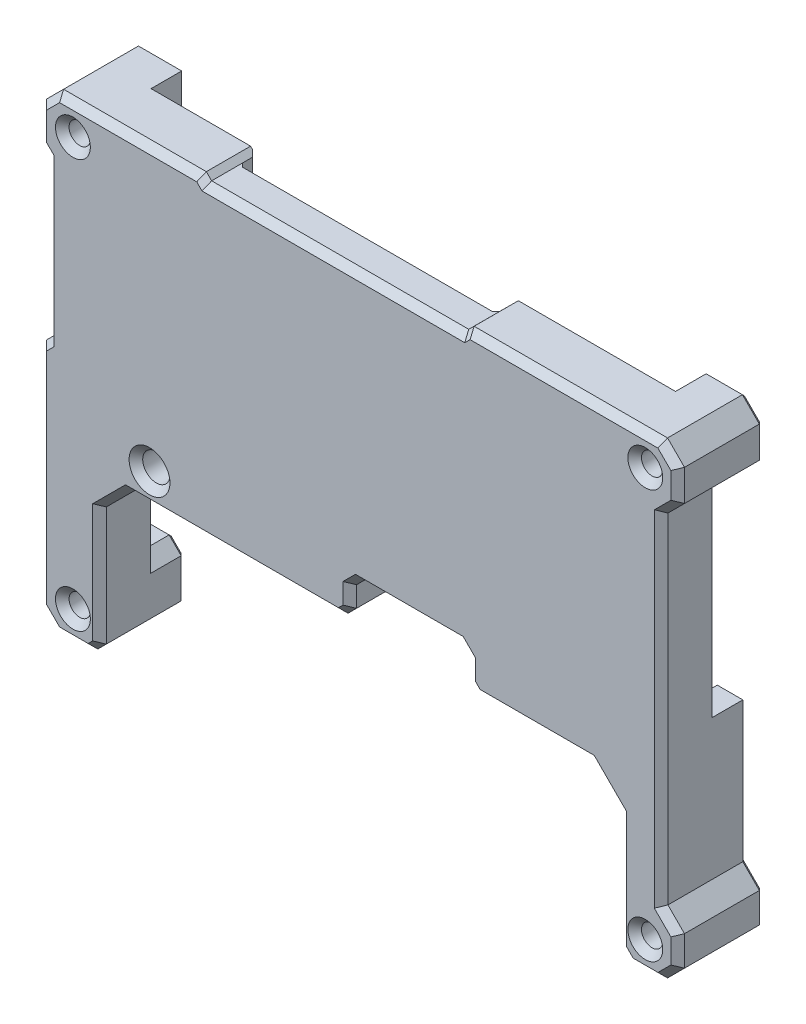
from build123d import *

# Parameters (mm, degrees)
SKETCH_1_W                = 85
SKETCH_1_H                = 65
EXTRUDE_1_DEPTH           = 10
CUT_EXTRUDE_1_REACH       = 109.471
SKETCH_2_R                = 1.25
CUT_EXTRUDE_2_REACH       = 109.471
SKETCH_3_W                = 85
SKETCH_3_H                = 65
CUT_EXTRUDE_4_REACH       = 102.464
CUT_EXTRUDE_7_DEPTH       = 6
CUT_EXTRUDE_8_DEPTH       = 6
CUT_EXTRUDE_11_DEPTH      = 4
SKETCH_8_W                = 8
SKETCH_8_H                = 5
CUT_EXTRUDE_12_DEPTH      = 1
SKETCH_10_W               = 5.4
SKETCH_10_H               = 6
SKETCH_10_W_2             = 4
EXTRUDE_2_DEPTH           = 2.040000001
SKETCH_11_W               = 4.2
SKETCH_11_H               = 5
EXTRUDE_3_DEPTH           = 1.300114616
SKETCH_12_W               = 12
SKETCH_12_H               = 6
EXTRUDE_4_DEPTH           = 1.89
SKETCH_13_W               = 3.114456334
SKETCH_13_H               = 4.982674998
EXTRUDE_5_DEPTH           = 4
SKETCH_15_W               = 14
SKETCH_15_H               = 4.4
CUT_EXTRUDE_13_DEPTH      = 6
CHAMFER_1_SIZE            = 1
CHAMFER_2_SIZE            = 0.6
CHAMFER_5_SIZE            = 0.6
CUT_EXTRUDE_14_DEPTH      = 101.144527295
CUT_EXTRUDE_14_DEPTH_BACK = 101.144527295
SKETCH_16_R               = 1.6
CUT_EXTRUDE_15_DEPTH      = 4
CUT_EXTRUDE_16_DEPTH      = 4
CHAMFER_6_SIZE            = 0.8
CHAMFER_7_SIZE            = 0.4
CHAMFER_8_SIZE            = 0.4
CHAMFER_9_SIZE            = 0.4
CHAMFER_11_SIZE           = 0.4


with BuildPart() as part:
    # 草图1 → 凸台-拉伸1 (new body)
    with BuildSketch(Plane.XY):
        with Locations((42.5, 32.5)):
            Rectangle(SKETCH_1_W, SKETCH_1_H)
    extrude(amount=EXTRUDE_1_DEPTH)

    # 草图2 → 切除-拉伸1 (cut, up to next)
    with BuildSketch(Plane(origin=(0, 0, 0), x_dir=(-1, 0, 0), z_dir=(0, 0, -1)), mode=Mode.PRIVATE) as cut_extrude_1_sk1:
        with Locations((-76.166921514, 56.442524765)):
            Circle(SKETCH_2_R)
    cut_extrude_1_tool1 = extrude(cut_extrude_1_sk1.sketch, amount=-CUT_EXTRUDE_1_REACH, mode=Mode.PRIVATE) & part.part
    # 草图2 → 切除-拉伸1 (cut, up to next)
    with BuildSketch(Plane(origin=(0, 0, 0), x_dir=(-1, 0, 0), z_dir=(0, 0, -1)), mode=Mode.PRIVATE) as cut_extrude_1_sk2:
        with Locations((-8.888803658, 56.442524765)):
            Circle(SKETCH_2_R)
    cut_extrude_1_tool2 = extrude(cut_extrude_1_sk2.sketch, amount=-CUT_EXTRUDE_1_REACH, mode=Mode.PRIVATE) & part.part
    # 草图2 → 切除-拉伸1 (cut, up to next)
    with BuildSketch(Plane(origin=(0, 0, 0), x_dir=(-1, 0, 0), z_dir=(0, 0, -1)), mode=Mode.PRIVATE) as cut_extrude_1_sk3:
        with Locations((-76.166921514, 8.41508509)):
            Circle(SKETCH_2_R)
    cut_extrude_1_tool3 = extrude(cut_extrude_1_sk3.sketch, amount=-CUT_EXTRUDE_1_REACH, mode=Mode.PRIVATE) & part.part
    # 草图2 → 切除-拉伸1 (cut, up to next)
    with BuildSketch(Plane(origin=(0, 0, 0), x_dir=(-1, 0, 0), z_dir=(0, 0, -1)), mode=Mode.PRIVATE) as cut_extrude_1_sk4:
        with Locations((-8.888803658, 8.41508509)):
            Circle(SKETCH_2_R)
    cut_extrude_1_tool4 = extrude(cut_extrude_1_sk4.sketch, amount=-CUT_EXTRUDE_1_REACH, mode=Mode.PRIVATE) & part.part
    add(cut_extrude_1_tool1.solids().sort_by_distance((76.166922, 56.442525, 0))[0], mode=Mode.SUBTRACT)
    add(cut_extrude_1_tool2.solids().sort_by_distance((8.888804, 56.442525, 0))[0], mode=Mode.SUBTRACT)
    add(cut_extrude_1_tool3.solids().sort_by_distance((76.166922, 8.415085, 0))[0], mode=Mode.SUBTRACT)
    add(cut_extrude_1_tool4.solids().sort_by_distance((8.888804, 8.415085, 0))[0], mode=Mode.SUBTRACT)

    # 草图3 → 切除-拉伸2 (cut, up to next)
    with BuildSketch(Plane(origin=(0, 0, 0), x_dir=(-1, 0, 0), z_dir=(0, 0, -1)), mode=Mode.PRIVATE) as cut_extrude_2_sk1:
        with Locations((-42.5, 32.5)):
            Rectangle(SKETCH_3_W, SKETCH_3_H)
        Polygon((-5, 33.462892894), (-5.871324699, 34.334217592), (-5.87504445, 53.137061214), (-5, 54.017366187), (-5, 57.982143592), (-6.992565577, 59.974709169), (-23.773560915, 59.974709169), (-24.394872914, 59.353397171), (-54.61482093, 59.349677419), (-55.245113202, 59.974709169), (-77.982184232, 59.974709169), (-79.974749809, 57.982143592), (-79.97474981, 54.295829484), (-78.032030648, 52.353110322), (-78.028310897, 12.45999492), (-79.97474981, 10.508295484), (-79.97474981, 6.992565577), (-77.982184232, 5), (-74.414239441, 5), (-73.152434681, 6.26180476), (-60.043505207, 6.265524511), (-58.772720173, 5), (-32.926479725, 5), (-31.743585303, 6.182894422), (-17.461559563, 6.186614173), (-16.269684867, 5), (-6.992565577, 5), (-5, 6.992565577), align=None, mode=Mode.SUBTRACT)
    cut_extrude_2_tool1 = extrude(cut_extrude_2_sk1.sketch, amount=-CUT_EXTRUDE_2_REACH, mode=Mode.PRIVATE) & part.part
    add(cut_extrude_2_tool1.solids().sort_by_distance((42.5, 63.929953, 0))[0], mode=Mode.SUBTRACT)

    # 草图4 → 切除-拉伸4 (cut, up to next)
    with BuildSketch(Plane(origin=(0, 0, 0), x_dir=(-1, 0, 0), z_dir=(0, 0, -1)), mode=Mode.PRIVATE) as cut_extrude_4_sk1:
        Polygon((-73.152434681, 6.26180476), (-73.152434681, 20.032317315), (-69.831576581, 23.353175415), (-46.787984184, 23.353175415), (-15.403761553, 23.353175415), (-12.014024846, 19.963438707), (-12.014024846, 6.188032983), (-12.014024846, 0.193960815), (-73.152434681, 0.193960815), align=None)
    cut_extrude_4_tool1 = extrude(cut_extrude_4_sk1.sketch, amount=-CUT_EXTRUDE_4_REACH, mode=Mode.PRIVATE) & part.part
    add(cut_extrude_4_tool1.solids().sort_by_distance((42.587983, 11.689717, 0))[0], mode=Mode.SUBTRACT)

    # 草图5 → 切除-拉伸7 (cut)
    with BuildSketch(Plane(origin=(0, 0, 0), x_dir=(-1, 0, 0), z_dir=(0, 0, -1))):
        Polygon((-24.394872914, 59.353397171), (-24.394872914, 53.906418167), (-25.526104495, 52.774908066), (-53.482640788, 52.774908066), (-54.614150889, 53.906139647), (-54.61482093, 59.349677419), align=None)
    extrude(amount=-CUT_EXTRUDE_7_DEPTH, mode=Mode.SUBTRACT)

    # 草图6 → 切除-拉伸8 (cut)
    with BuildSketch(Plane(origin=(0, 0, 0), x_dir=(-1, 0, 0), z_dir=(0, 0, -1))):
        Polygon((-5.871324699, 34.334217592), (-11.671324699, 34.334217592), (-11.671324699, 50.334217592), (-5.874489966, 50.334217592), (-5.873484235, 45.250384759), align=None)
    extrude(amount=-CUT_EXTRUDE_8_DEPTH, mode=Mode.SUBTRACT)

    # 草图7 → 切除-拉伸11 (cut)
    with BuildSketch(Plane(origin=(0, 0, 0), x_dir=(-1, 0, 0), z_dir=(0, 0, -1))):
        Polygon((-74.432117646, 51.26230094), (-76.432117646, 51.26230094), (-78.031928938, 51.26230094), (-78.029847328, 28.93771831), (-75.029847328, 28.93771831), (-75.029847328, 13.93771831), (-73.152434681, 12.060305663), (-73.152434681, 20.032317315), (-69.831576581, 23.353175415), (-15.403761553, 23.353175415), (-12.014024846, 19.963438707), (-12.014024846, 10.599811284), (-10.599811284, 12.014024847), (-6.599811284, 12.014024847), (-5, 12.014024847), (-5, 33.462892894), (-5.871324699, 34.334217592), (-11.671324699, 34.334217592), (-11.671324699, 50.334217592), (-5.874489966, 50.334217592), (-5.87504445, 53.137061214), (-9.87504445, 53.137061214), (-12.071959353, 55.333976117), (-12.071959353, 58.333976117), (-23.061659554, 58.333976117), (-23.732127818, 57.663342778), (-24.394872914, 57.663261201), (-24.394872914, 53.906418167), (-25.526104495, 52.774908066), (-53.482640788, 52.774908066), (-54.614150889, 53.906139647), (-54.61482093, 59.349677419), (-55.245113202, 59.974709169), (-71.319520701, 59.974709169), (-71.319520701, 58.374897885), (-71.319520701, 54.374897885), align=None)
    extrude(amount=-CUT_EXTRUDE_11_DEPTH, mode=Mode.SUBTRACT)

    # 草图8 → 切除-拉伸12 (cut)
    with BuildSketch(Plane(origin=(0, 0, 4), x_dir=(-1, 0, 0), z_dir=(0, 0, -1))):
        with Locations((-69.348077333, 43.45871309)):
            Rectangle(SKETCH_8_W, SKETCH_8_H)
    extrude(amount=-CUT_EXTRUDE_12_DEPTH, mode=Mode.SUBTRACT)

    # 草图10 → 凸台-拉伸2 (add)
    with BuildSketch(Plane(origin=(0, 0, 4), x_dir=(-1, 0, 0), z_dir=(0, 0, -1))):
        with Locations((-44.246532103, 31.889800214)):
            Rectangle(SKETCH_10_W, SKETCH_10_H)
        with Locations((-39.546532103, 31.889800214)):
            Rectangle(SKETCH_10_W_2, SKETCH_10_H)
        with Locations((-34.846532103, 31.889800214)):
            Rectangle(SKETCH_10_W, SKETCH_10_H)
    extrude(amount=EXTRUDE_2_DEPTH)

    # 草图11 → 凸台-拉伸3 (add)
    with BuildSketch(Plane(origin=(0, 0, 4), x_dir=(-1, 0, 0), z_dir=(0, 0, -1))):
        with Locations((-38.731800654, 41.192864876)):
            Rectangle(SKETCH_11_W, SKETCH_11_H)
    extrude(amount=EXTRUDE_3_DEPTH)

    # 草图12 → 凸台-拉伸4 (add)
    with BuildSketch(Plane(origin=(0, 0, 4), x_dir=(-1, 0, 0), z_dir=(0, 0, -1))):
        with Locations((-24.610605003, 27.685920752)):
            Rectangle(SKETCH_12_W, SKETCH_12_H)
        Polygon((-30.610605003, 30.685920752), (-24.610605003, 30.685920752), (-32.146532103, 34.889800214), (-32.146532103, 28.889800214), (-30.610605003, 27.685920752), align=None)
    extrude(amount=EXTRUDE_4_DEPTH)

    # 草图13 → 凸台-拉伸5 (add)
    with BuildSketch(Plane(origin=(0, 0, 4), x_dir=(-1, 0, 0), z_dir=(0, 0, -1))):
        with Locations((-61.333013133, 38.127509711)):
            Rectangle(SKETCH_13_W, SKETCH_13_H)
    extrude(amount=EXTRUDE_5_DEPTH)

    # 草图15 → 切除-拉伸13 (cut)
    with BuildSketch(Plane.XY.offset(10)):
        with Locations((48.428848604, 25.553175415)):
            Rectangle(SKETCH_15_W, SKETCH_15_H)
    extrude(amount=-CUT_EXTRUDE_13_DEPTH, mode=Mode.SUBTRACT)

    # 倒角1
    chamfer_1_edges = [part.edges().sort_by_distance(p)[0] for p in [
        (12.014024846, 5, 5),
        (55.428848604, 23.353175415, 7),
        (55.428848604, 27.753175415, 7),
        (41.428848604, 27.753175415, 7),
        (41.428848604, 23.353175415, 7),
    ]]
    chamfer(chamfer_1_edges, length=CHAMFER_1_SIZE)

    # 倒角2
    chamfer_2_edges = [part.edges().sort_by_distance(p)[0] for p in [
        (62.8902413, 38.127509711, 4),
        (61.333013133, 35.636172212, 4),
        (59.775784966, 38.127509711, 4),
        (61.333013133, 40.61884721, 4),
    ]]
    chamfer(chamfer_2_edges, length=CHAMFER_2_SIZE)

    # 倒角5
    chamfer_5_edges = [part.edges().sort_by_distance(p)[0] for p in [
        (38.731800654, 43.692864876, 4),
        (36.631800654, 41.192864876, 4),
        (38.731800654, 38.692864876, 4),
        (40.831800654, 41.192864876, 4),
    ]]
    chamfer(chamfer_5_edges, length=CHAMFER_5_SIZE)

    # 草图16 → 切除-拉伸14 (cut, two sides: drawn at the far end of the back side and taken through both)
    with BuildSketch(Plane(origin=(0, 0, 4), x_dir=(-1, 0, 0), z_dir=(0, 0, -1)).offset(-CUT_EXTRUDE_14_DEPTH_BACK)):
        with Locations((-17.894129073, 26.946261069)):
            Circle(SKETCH_16_R)
    extrude(amount=CUT_EXTRUDE_14_DEPTH + CUT_EXTRUDE_14_DEPTH_BACK, mode=Mode.SUBTRACT)

    # 草图17 → 切除-拉伸15 (cut)
    with BuildSketch(Plane(origin=(0, 0, 0), x_dir=(-1, 0, 0), z_dir=(0, 0, -1))):
        Polygon((-23.061659554, 58.333976117), (-12.071959353, 58.333976117), (-12.071959353, 59.974709169), (-23.773560915, 59.974709169), (-24.394872914, 59.353397171), (-24.394872914, 57.663261201), (-23.732127818, 57.663342778), align=None)
    extrude(amount=-CUT_EXTRUDE_15_DEPTH, mode=Mode.SUBTRACT)

    # 草图18 → 切除-拉伸16 (cut)
    with BuildSketch(Plane(origin=(0, 0, 0), x_dir=(-1, 0, 0), z_dir=(0, 0, -1))):
        Polygon((-71.319520701, 59.974709169), (-73.719520701, 59.974709169), (-73.719520701, 54.050166597), (-75.416576976, 52.353110322), (-78.032030648, 52.353110322), (-78.031928938, 51.26230094), (-74.432117646, 51.26230094), (-71.319520701, 54.374897885), align=None)
    extrude(amount=-CUT_EXTRUDE_16_DEPTH, mode=Mode.SUBTRACT)

    # 倒角6
    chamfer_6_edges = [part.edges().sort_by_distance(p)[0] for p in [
        (73.152434681, 13.147061037, 10),
        (71.492005631, 21.692746365, 10),
        (63.130212592, 23.353175415, 10),
        (13.7088932, 21.658307061, 10),
        (12.014024846, 12.981719354, 10),
        (10.138803658, 56.442524765, 10),
        (77.416921514, 8.41508509, 10),
        (10.138803658, 8.41508509, 10),
        (77.416921514, 56.442524765, 10),
        (48.428848604, 27.753175415, 10),
        (55.428848604, 25.553175415, 10),
        (27.916305079, 23.353175415, 10),
        (41.428848604, 25.553175415, 10),
        (55.928848604, 23.853175415, 10),
        (40.928848604, 23.853175415, 10),
        (11.514024846, 5.5, 10),
        (41.928848604, 27.253175415, 10),
        (54.928848604, 27.253175415, 10),
        (19.494129073, 26.946261069, 10),
        (5.873184574, 43.735639403, 10),
        (5.435662349, 33.898555243, 10),
        (5, 20.227729235, 10),
        (5.996282789, 5.996282789, 10),
        (9.003295212, 5, 10),
        (73.783337061, 5.63090238, 10),
        (76.198211836, 5, 10),
        (78.978467021, 5.996282789, 10),
        (79.97474981, 8.750430531, 10),
        (79.001530353, 11.484145202, 10),
        (78.030170772, 32.406552621, 10),
        (79.003390229, 53.324469903, 10),
        (79.974749809, 56.138986538, 10),
        (78.978467021, 58.978426381, 10),
        (66.613648717, 59.974709169, 10),
        (54.929967066, 59.662193294, 10),
        (39.504846922, 59.351537295, 10),
        (24.084216914, 59.66405317, 10),
        (15.383063246, 59.974709169, 10),
        (5.996282789, 58.978426381, 10),
        (5, 55.99975489, 10),
        (5.437522225, 53.577213701, 10),
    ]]
    chamfer(chamfer_6_edges, length=CHAMFER_6_SIZE)

    # 倒角7
    chamfer_7_edges = [part.edges().sort_by_distance(p)[0] for p in [
        (10.138803658, 56.442524765, 0),
        (73.152434681, 9.161055212, 0),
        (78.029079112, 20.698856615, 0),
        (77.416921514, 8.41508509, 0),
        (7.799905642, 12.014024847, 0),
        (11.306918066, 11.306918066, 0),
        (74.091141004, 12.999011987, 0),
        (12.071959353, 57.654342643, 0),
        (10.973501901, 54.235518665, 0),
        (7.87504445, 53.137061214, 0),
        (10.138803658, 8.41508509, 0),
        (76.529847328, 28.93771831, 0),
        (75.029847328, 21.43771831, 0),
        (77.416921514, 56.442524765, 0),
        (38.731800654, 43.692864876, 2.699885384),
        (36.631800654, 41.192864876, 2.699885384),
        (38.731800654, 38.692864876, 2.699885384),
        (40.831800654, 41.192864876, 2.699885384),
        (61.333013133, 40.61884721, 0),
        (62.8902413, 38.127509711, 0),
        (61.333013133, 35.636172212, 0),
        (59.775784966, 38.127509711, 0),
        (9.003295212, 5, 0),
        (12.014024846, 8.299905642, 0),
        (11.514024846, 5.5, 0),
        (75.850852466, 59.974709169, 0),
        (74.568048838, 53.20163846, 0),
        (76.724303812, 52.353110322, 0),
        (73.719520701, 57.012437883, 0),
        (5, 9.503295212, 0),
        (5.996282789, 5.996282789, 0),
        (73.783337061, 5.63090238, 0),
        (76.198211836, 5, 0),
        (78.978467021, 5.996282789, 0),
        (79.97474981, 8.750430531, 0),
        (79.001530353, 11.484145202, 0),
        (79.003390229, 53.324469903, 0),
        (79.974749809, 56.138986538, 0),
        (78.978467021, 58.978426381, 0),
        (9.532262465, 59.974709169, 0),
        (5.996282789, 58.978426381, 0),
        (5, 55.99975489, 0),
        (5.437522225, 53.577213701, 0),
    ]]
    chamfer(chamfer_7_edges, length=CHAMFER_7_SIZE)

    # 倒角8
    chamfer_8_edges = [part.edges().sort_by_distance(p)[0] for p in [
        (8.771324699, 34.334217592, 6),
        (11.671324699, 42.334217592, 6),
        (11.671324699, 34.334217592, 5),
        (8.772907332, 50.334217592, 6),
        (11.671324699, 50.334217592, 5),
        (8.772907332, 50.334217592, 4),
        (11.671324699, 42.334217592, 4),
        (8.771324699, 34.334217592, 4),
    ]]
    chamfer(chamfer_8_edges, length=CHAMFER_8_SIZE)

    # 倒角9
    chamfer_9_edges = [part.edges().sort_by_distance(p)[0] for p in [
        (24.394872914, 56.629907669, 6),
        (24.960488704, 53.340663116, 6),
        (39.504372641, 52.774908066, 6),
        (54.048395838, 53.340523857, 6),
        (54.614485909, 56.627908533, 6),
        (54.614485909, 56.627908533, 4),
        (54.048395838, 53.340523857, 4),
        (39.504372641, 52.774908066, 4),
        (24.960488704, 53.340663116, 4),
        (24.394872914, 56.629907669, 4),
    ]]
    chamfer(chamfer_9_edges, length=CHAMFER_9_SIZE)

    # 倒角11
    chamfer_11_edges = [part.edges().sort_by_distance(p)[0] for p in [
        (73.348077333, 43.45871309, 5),
        (69.348077333, 45.95871309, 5),
        (65.348077333, 43.45871309, 5),
        (69.348077333, 40.95871309, 5),
    ]]
    chamfer(chamfer_11_edges, length=CHAMFER_11_SIZE)


solid = part.part
